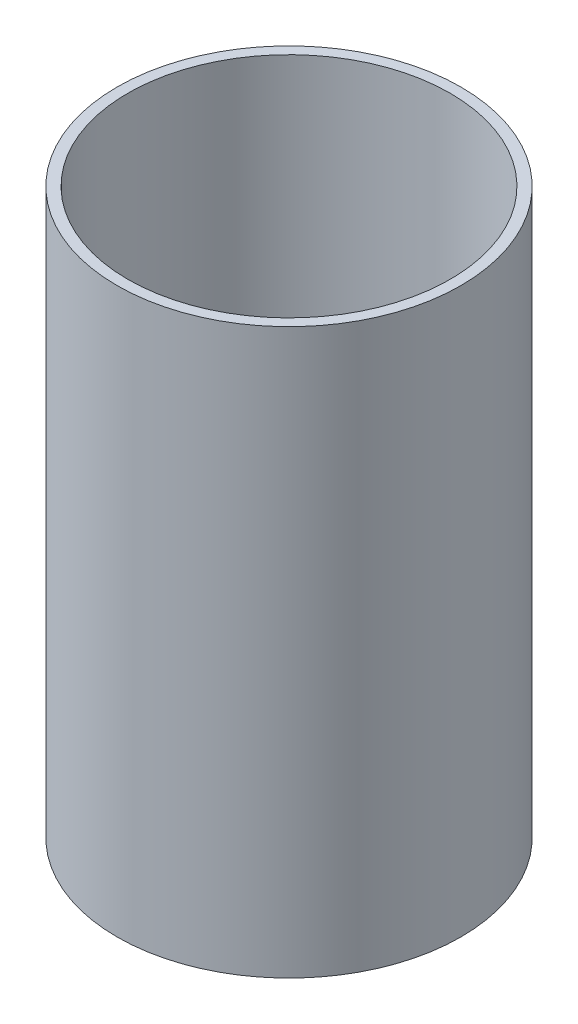
from build123d import *

# Parameters (mm, degrees)
SKETCH1_R           = 0.6096
SKETCH1_R_2         = 0.5715
BOSS_EXTRUDE1_DEPTH = 2


with BuildPart() as part:
    # Sketch1 → Boss-Extrude1 (new body)
    with BuildSketch(Plane(origin=(0, 0, 0), x_dir=(1, 0, 0), z_dir=(0, 1, 0))):
        with Locations(Location((0, 0, 0), (0, 0, 270))):
            Circle(SKETCH1_R)
        with Locations(Location((0, 0, 0), (0, 0, 270))):
            Circle(SKETCH1_R_2, mode=Mode.SUBTRACT)
    extrude(amount=BOSS_EXTRUDE1_DEPTH)


solid = part.part
